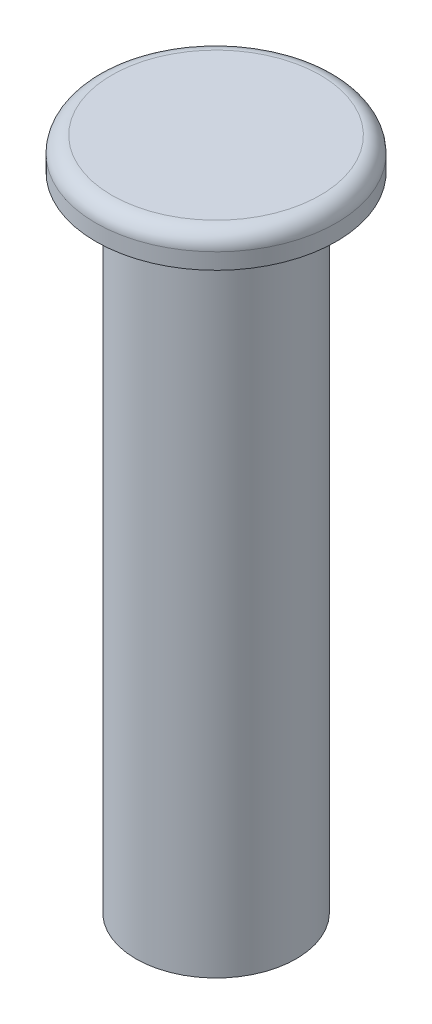
from build123d import *

# Parameters (mm, degrees)
SKETCH_1_R      = 0.5
EXTRUDE_1_DEPTH = 4
SKETCH_2_R      = 0.75
EXTRUDE_2_DEPTH = 0.2
FILLET_1_R      = 0.1


with BuildPart() as part:
    # 草图1 → 凸台-拉伸1 (new body)
    with BuildSketch(Plane(origin=(0, 0, 0), x_dir=(1, 0, 0), z_dir=(0, 1, 0))):
        with Locations(Location((0, 0, 0), (0, 0, 270))):
            Circle(SKETCH_1_R)
    extrude(amount=EXTRUDE_1_DEPTH)

    # 草图2 → 凸台-拉伸2 (add)
    with BuildSketch(Plane(origin=(0, 4, 0), x_dir=(1, 0, 0), z_dir=(0, 1, 0))):
        with Locations(Location((0, 0, 0), (0, 0, 270))):
            Circle(SKETCH_2_R)
    extrude(amount=EXTRUDE_2_DEPTH)

    # 圆角1
    fillet_1_edges = [part.edges().sort_by_distance(p)[0] for p in [
        (0, 4.2, -0.75),
    ]]
    fillet(fillet_1_edges, radius=FILLET_1_R)


solid = part.part
